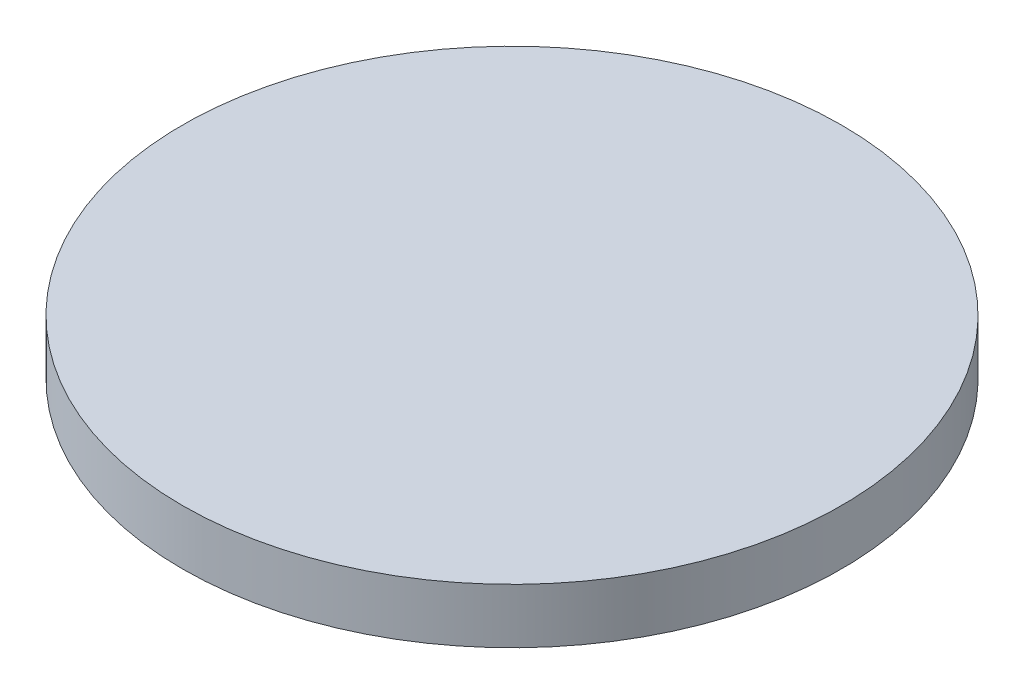
from build123d import *

# Parameters (mm, degrees)
MAIN_SHAPE_PROFILE_W = 38.1
MAIN_SHAPE_PROFILE_H = 6.35


with BuildPart() as part:
    # Main Shape Profile → Main Shape (revolve)
    with BuildSketch(Plane.XY, mode=Mode.PRIVATE) as main_shape_sk:
        with Locations((19.05, 3.175)):
            Rectangle(MAIN_SHAPE_PROFILE_W, MAIN_SHAPE_PROFILE_H)
    revolve(main_shape_sk.sketch.rotate(Axis((0, 0, 0), (0, -1, 0)), 90), axis=Axis((0, 0, 0), (0, -1, 0)))


solid = part.part
